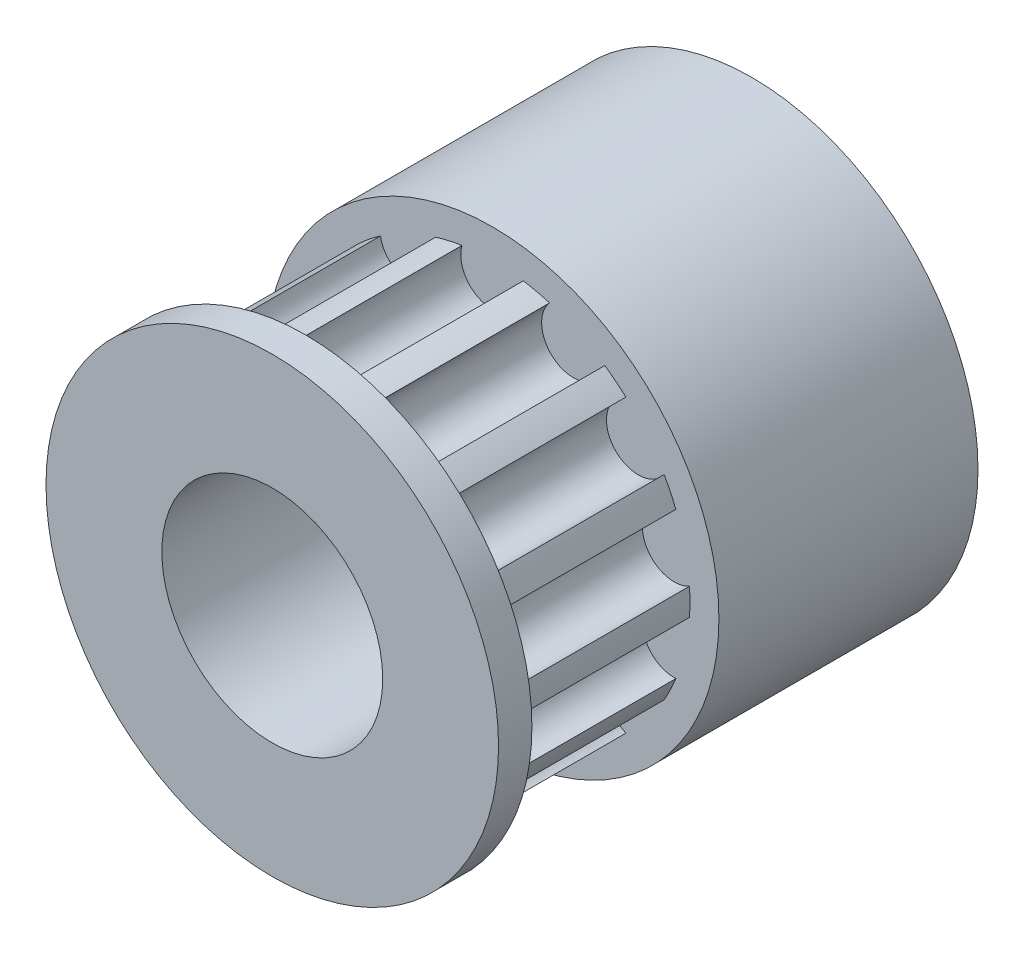
from build123d import *

# Parameters (mm, degrees)
CUT_EXTRUDE1_START = 3.229191933
CUT_EXTRUDE1_DEPTH = 3.229191933


with BuildPart() as part:
    # Sketch1 → Revolve2 (revolve)
    with BuildSketch(Plane(origin=(0, 0, 0), x_dir=(0, 0, -1), z_dir=(1, 0, 0)), mode=Mode.PRIVATE) as revolve2_sk:
        Polygon((4.77917475, 3.907122765), (3.805254495, 3.907122765), (3.805254495, 3.407122765), (0.576062562, 3.407122765), (0.576062562, 3.907122765), (0, 3.907122765), (0, 1.907122765), (4.77917475, 1.907122765), (8.27917475, 1.907122765), (8.27917475, 3.753666669), (8.27917475, 3.907122765), align=None)
    revolve(revolve2_sk.sketch.rotate(Axis((0, 0, 0), (0, 0, -1)), 90), axis=Axis((0, 0, 0), (0, 0, -1)))

    # Sketch3 → Cut-Extrude1 (cut)
    with BuildSketch(Plane.XY.offset(-3.805254495).offset(CUT_EXTRUDE1_START)):
        with BuildLine():
            ThreePointArc((-2.301258727, 2.512507474), (-2.663795842, 2.124306298), (-2.961591907, 1.684475857))
            ThreePointArc((-2.961591907, 1.684475857), (-2.085240545, 1.662923844), (-2.301258727, 2.512507474))
        make_face()
        with BuildLine():
            ThreePointArc((-0.529546095, 3.365719309), (0, 2.667122765), (0.529546095, 3.365719309))
            ThreePointArc((0.529546095, 3.365719309), (0, 3.407122765), (-0.529546095, 3.365719309))
        make_face()
        with BuildLine():
            ThreePointArc((0.983226333, 3.262169756), (1.157221198, 2.402994578), (1.937435425, 2.802646876))
            ThreePointArc((1.937435425, 2.802646876), (1.478295165, 3.06971154), (0.983226333, 3.262169756))
        make_face()
        with BuildLine():
            ThreePointArc((2.301258727, 2.512507474), (2.085240545, 1.662923844), (2.961591907, 1.684475857))
            ThreePointArc((2.961591907, 1.684475857), (2.663795842, 2.124306298), (2.301258727, 2.512507474))
        make_face()
        with BuildLine():
            ThreePointArc((3.163498608, 1.265212273), (2.600252429, 0.593490649), (3.399168791, 0.232673735))
            ThreePointArc((3.399168791, 0.232673735), (3.321699084, 0.75815614), (3.163498608, 1.265212273))
        make_face()
        with BuildLine():
            ThreePointArc((3.399168791, -0.232673735), (2.600252429, -0.593490649), (3.163498608, -1.265212273))
            ThreePointArc((3.163498608, -1.265212273), (3.321699084, -0.75815614), (3.399168791, -0.232673735))
        make_face()
        with BuildLine():
            ThreePointArc((2.961591907, -1.684475857), (2.085240545, -1.662923844), (2.301258727, -2.512507474))
            ThreePointArc((2.301258727, -2.512507474), (2.663795842, -2.124306298), (2.961591907, -1.684475857))
        make_face()
        with BuildLine():
            ThreePointArc((1.937435425, -2.802646876), (1.157221198, -2.402994578), (0.983226333, -3.262169756))
            ThreePointArc((0.983226333, -3.262169756), (1.478295165, -3.06971154), (1.937435425, -2.802646876))
        make_face()
        with BuildLine():
            ThreePointArc((0.529546095, -3.365719309), (0, -2.667122765), (-0.529546095, -3.365719309))
            ThreePointArc((-0.529546095, -3.365719309), (0, -3.407122765), (0.529546095, -3.365719309))
        make_face()
        with BuildLine():
            ThreePointArc((-0.983226333, -3.262169756), (-1.157221198, -2.402994578), (-1.937435425, -2.802646876))
            ThreePointArc((-1.937435425, -2.802646876), (-1.478295165, -3.06971154), (-0.983226333, -3.262169756))
        make_face()
        with BuildLine():
            ThreePointArc((-2.301258727, -2.512507474), (-2.085240545, -1.662923844), (-2.961591907, -1.684475857))
            ThreePointArc((-2.961591907, -1.684475857), (-2.663795842, -2.124306298), (-2.301258727, -2.512507474))
        make_face()
        with BuildLine():
            ThreePointArc((-3.163498608, -1.265212273), (-2.600252429, -0.593490649), (-3.399168791, -0.232673735))
            ThreePointArc((-3.399168791, -0.232673735), (-3.321699084, -0.75815614), (-3.163498608, -1.265212273))
        make_face()
        with BuildLine():
            ThreePointArc((-3.399168791, 0.232673735), (-2.600252429, 0.593490649), (-3.163498608, 1.265212273))
            ThreePointArc((-3.163498608, 1.265212273), (-3.321699084, 0.75815614), (-3.399168791, 0.232673735))
        make_face()
        with BuildLine():
            ThreePointArc((-1.937435425, 2.802646876), (-1.157221198, 2.402994578), (-0.983226333, 3.262169756))
            ThreePointArc((-0.983226333, 3.262169756), (-1.478295165, 3.06971154), (-1.937435425, 2.802646876))
        make_face()
    extrude(amount=-CUT_EXTRUDE1_DEPTH, mode=Mode.SUBTRACT)


solid = part.part
